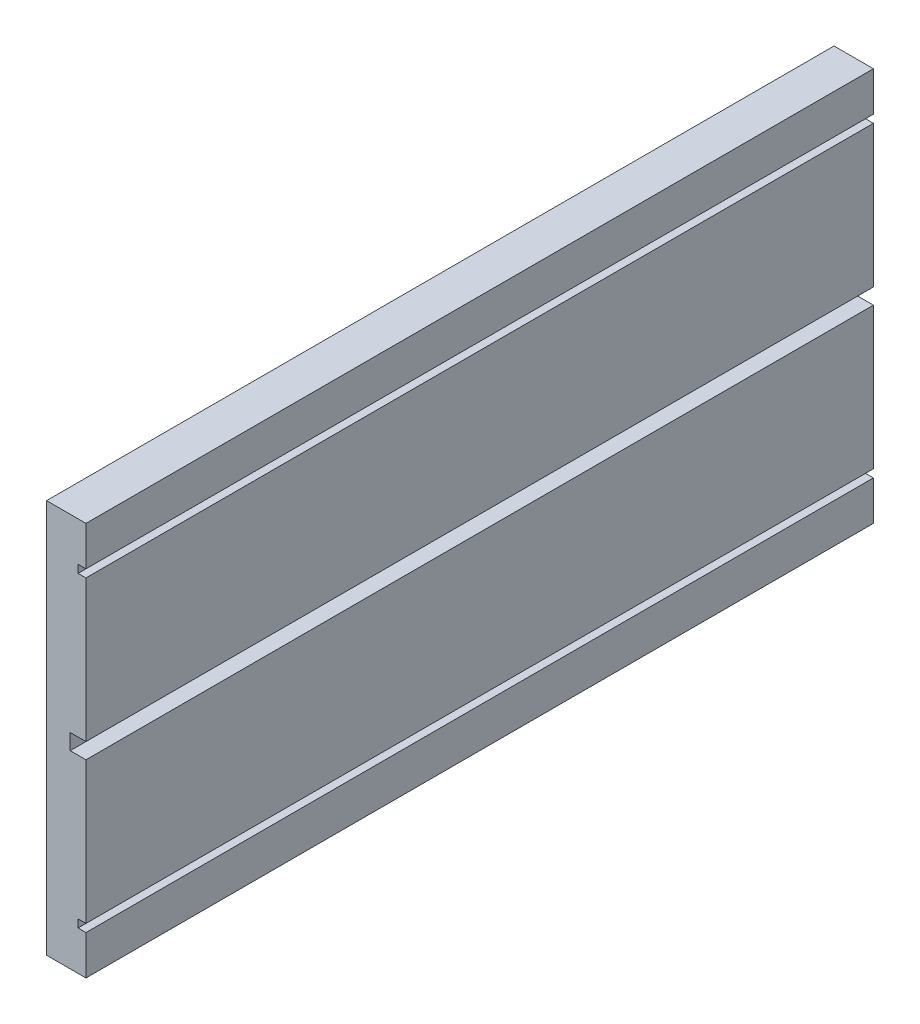
from build123d import *

# Parameters (mm, degrees)
IZIM1_W                     = 0.05
IZIM1_H                     = 0.5
Y_KSEKLIK_EKSTR_ZYON1_DEPTH = 1
IZIM2_W                     = 1
IZIM2_H                     = 0.01
KES_EKSTR_ZYON2_DEPTH       = 0.01
IZIM4_W                     = 1
IZIM4_H                     = 0.02
KES_EKSTR_ZYON3_DEPTH       = 0.02


with BuildPart() as part:
    # Çizim1 → Yükseklik-Ekstrüzyon1 (new body)
    with BuildSketch(Plane.XY):
        Rectangle(IZIM1_W, IZIM1_H)
    extrude(amount=Y_KSEKLIK_EKSTR_ZYON1_DEPTH)

    # Çizim2 → Kes-Ekstrüzyon2 (cut)
    with BuildSketch(Plane(origin=(0.025, 0, 0), x_dir=(0, 0, -1), z_dir=(1, 0, 0))):
        with Locations((-0.5, 0.195)):
            Rectangle(IZIM2_W, IZIM2_H)
        with Locations((-0.5, -0.195)):
            Rectangle(IZIM2_W, IZIM2_H)
    extrude(amount=-KES_EKSTR_ZYON2_DEPTH, mode=Mode.SUBTRACT)

    # Çizim4 → Kes-Ekstrüzyon3 (cut)
    with BuildSketch(Plane(origin=(0.025, 0, 0), x_dir=(0, 0, -1), z_dir=(1, 0, 0))):
        with Locations((-0.5, 0)):
            Rectangle(IZIM4_W, IZIM4_H)
    extrude(amount=-KES_EKSTR_ZYON3_DEPTH, mode=Mode.SUBTRACT)


solid = part.part
